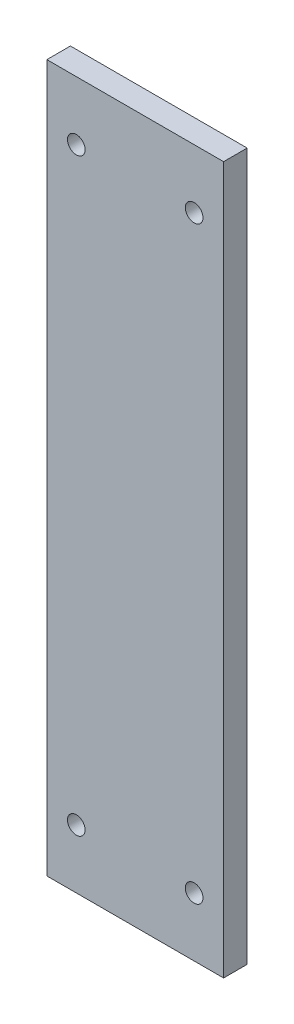
from build123d import *

# Parameters (mm, degrees)
SKETCH_1_W      = 30
SKETCH_1_H      = 120
SKETCH_1_R      = 1.5
EXTRUDE_1_DEPTH = 4


with BuildPart() as part:
    # 草图1 → 凸台-拉伸1 (new body)
    with BuildSketch(Plane.XY):
        with Locations((-9.19250872, -6.156790186)):
            Rectangle(SKETCH_1_W, SKETCH_1_H)
        with Locations((-19.19250872, -56.156790186)):
            Circle(SKETCH_1_R, mode=Mode.SUBTRACT)
        with Locations((0.80749128, -56.156790186)):
            Circle(SKETCH_1_R, mode=Mode.SUBTRACT)
        with Locations((0.80749128, 43.843209814)):
            Circle(SKETCH_1_R, mode=Mode.SUBTRACT)
        with Locations((-19.19250872, 43.843209814)):
            Circle(SKETCH_1_R, mode=Mode.SUBTRACT)
    extrude(amount=EXTRUDE_1_DEPTH)


solid = part.part
